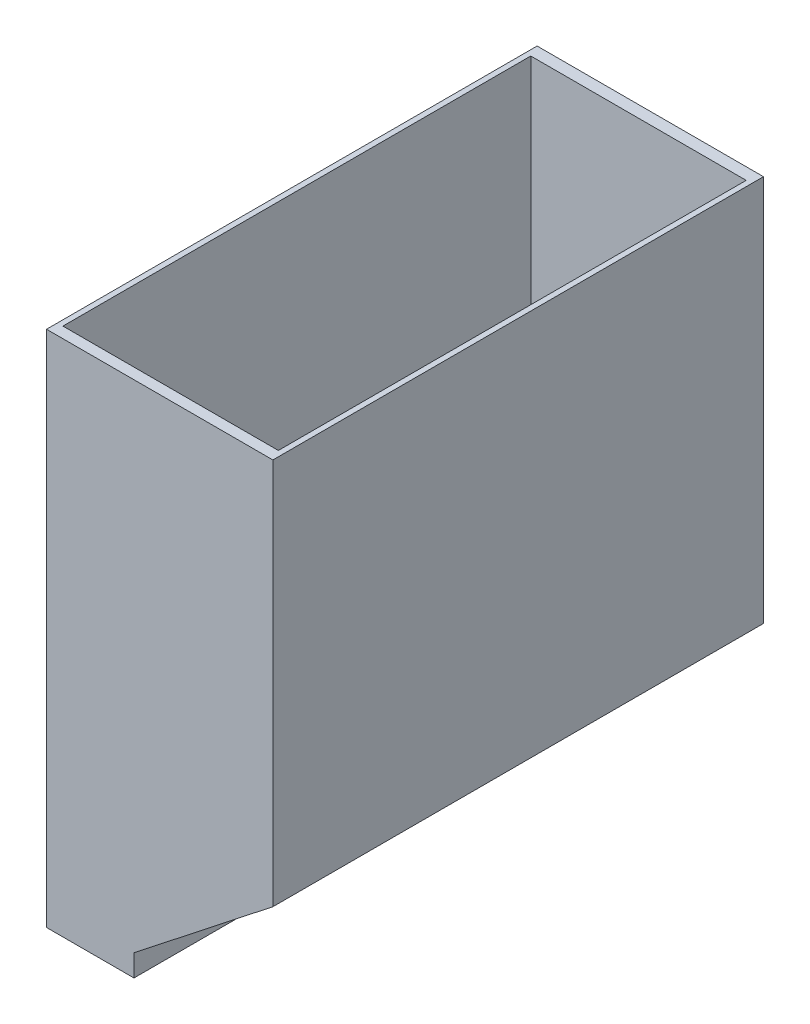
from build123d import *

# Parameters (mm, degrees)
BOSS_EXTRU_1_DEPTH      = 285
ENL_V_MAT_EXTRU_1_DEPTH = 543.56
ESQUISSE4_W             = 6.35
ESQUISSE4_H             = 25.4
BOSS_EXTRU_2_DEPTH      = 95.25


with BuildPart() as part:
    # Esquisse1 → Boss.-Extru.1 (new, symmetric)
    with BuildSketch(Plane.XY):
        Polygon((-29.9, -288.29), (131.5, -161.29), (131.5, 288.29), (-131.5, 288.29), (-131.5, -288.29), (-36.25, -288.29), (-36.25, -313.69), (-29.9, -313.69), align=None)
    extrude(amount=BOSS_EXTRU_1_DEPTH, both=True)

    # Esquisse2 → Enlèv. mat.-Extru.1 (cut)
    with BuildSketch(Plane.XY.offset(272.3)):
        Polygon((-125.15, 288.29), (-125.15, -288.29), (-40.168758445, -288.29), (125.15, -158.206466403), (125.15, 288.29), align=None)
    extrude(amount=-ENL_V_MAT_EXTRU_1_DEPTH, mode=Mode.SUBTRACT)

    # Esquisse4 → Boss.-Extru.2 (add)
    with BuildSketch(Plane.ZY.offset(36.25)):
        with Locations((-281.825, -300.99)):
            Rectangle(ESQUISSE4_W, ESQUISSE4_H)
    boss_extru_2 = extrude(amount=BOSS_EXTRU_2_DEPTH)

    # Symétrie1: Boss.-Extru.2 across plane
    add(boss_extru_2.mirror(Plane.XY))


solid = part.part
